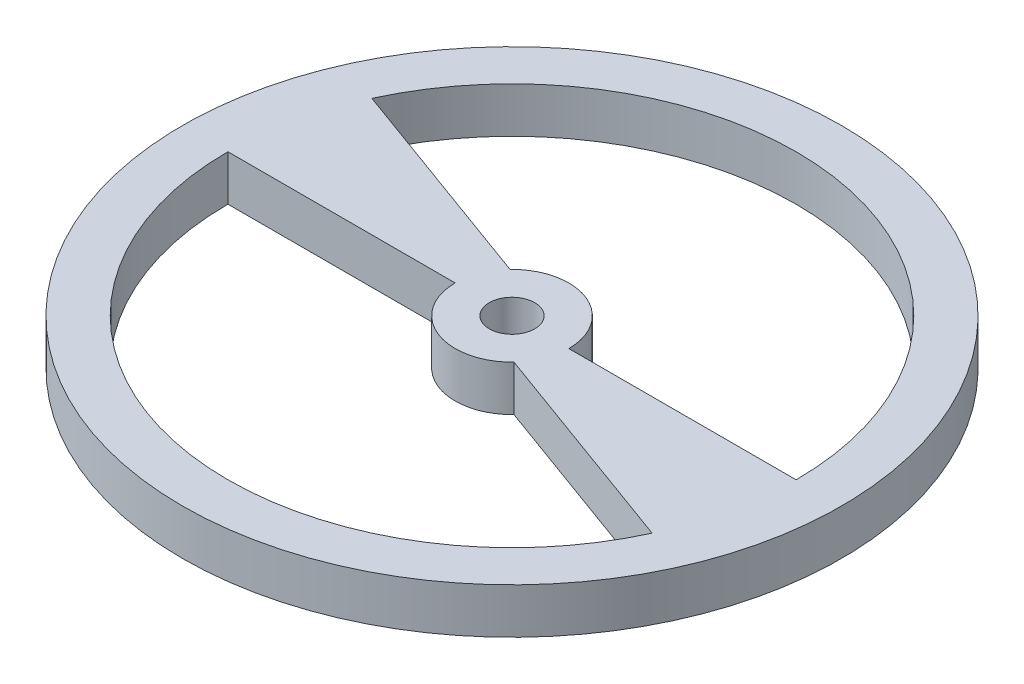
from build123d import *

# Parameters (mm, degrees)
SKETCH1_R           = 14.5
SKETCH1_R_2         = 1
BOSS_EXTRUDE1_DEPTH = 2


with BuildPart() as part:
    # Sketch1 → Boss-Extrude1 (new body)
    with BuildSketch(Plane(origin=(0, 0, 0), x_dir=(1, 0, 0), z_dir=(0, 1, 0))):
        with Locations(Location((0, 0, 0), (0, 0, 270))):
            Circle(SKETCH1_R)
        with Locations(Location((0, 0, 0), (0, 0, 270))):
            Circle(SKETCH1_R_2, mode=Mode.SUBTRACT)
        with BuildLine():
            Line((-2.5, 0), (-12.5, 0))
            ThreePointArc((-12.5, 0), (-2.661661161, -12.213335329), (11.366489578, -5.201241647))
            Line((11.366489578, -5.201241647), (1.811086139, -1.723359219))
            ThreePointArc((1.811086139, -1.723359219), (-0.927977546, -2.321391323), (-2.5, 0))
        make_face(mode=Mode.SUBTRACT)
        with BuildLine():
            Line((-11.366489578, 5.201241647), (-1.811086139, 1.723359219))
            ThreePointArc((-1.811086139, 1.723359219), (0.927977546, 2.321391323), (2.5, 0))
            Line((2.5, 0), (12.5, 0))
            ThreePointArc((12.5, 0), (2.661661161, 12.213335329), (-11.366489578, 5.201241647))
        make_face(mode=Mode.SUBTRACT)
    extrude(amount=BOSS_EXTRUDE1_DEPTH)


solid = part.part
